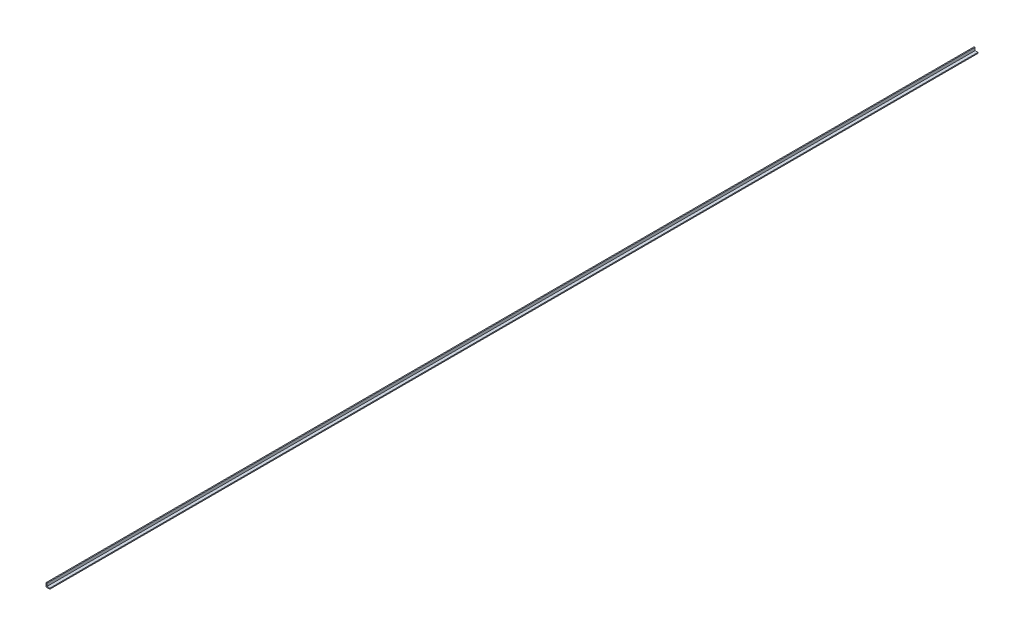
from build123d import *

# Parameters (mm, degrees)
SALIENTE_EXTRUIR1_DEPTH = 6100


with BuildPart() as part:
    # Croquis1 → Saliente-Extruir1 (new body)
    with BuildSketch(Plane.XY):
        Polygon((0, 25.4), (0, 0), (25.4, 0), (25.4, 6.35), (6.35, 6.35), (6.35, 25.4), align=None)
    extrude(amount=-SALIENTE_EXTRUIR1_DEPTH)


solid = part.part
